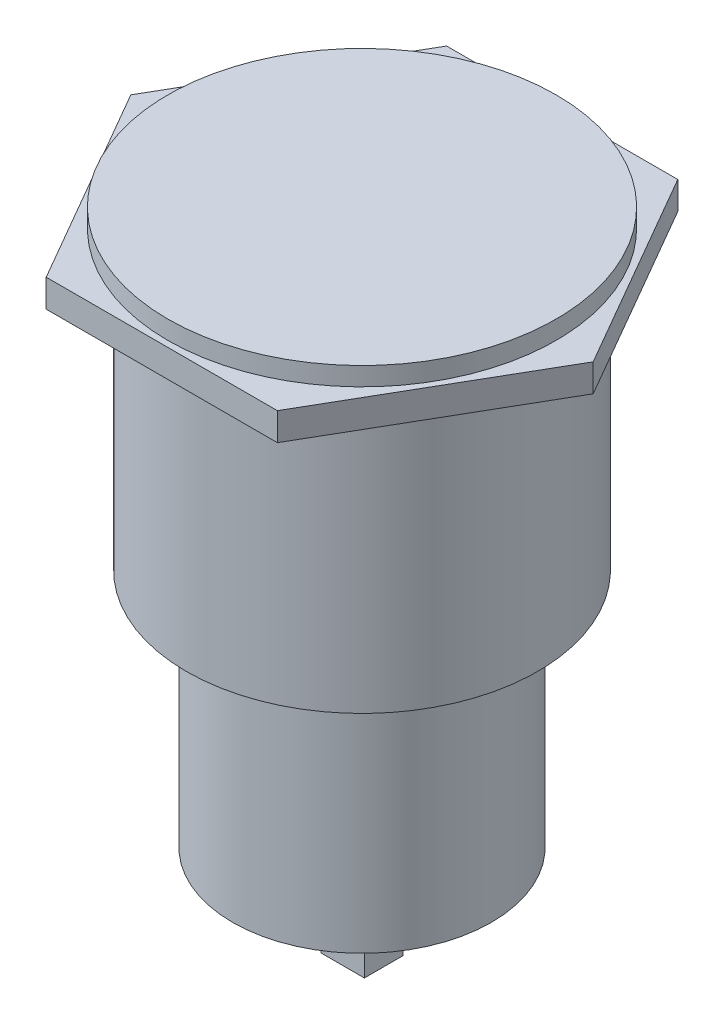
from build123d import *

# Parameters (mm, degrees)
SKETCH1_R           = 9.5
BOSS_EXTRUDE1_DEPTH = 14.5
SKETCH2_R           = 7
BOSS_EXTRUDE2_DEPTH = 13
BOSS_EXTRUDE3_DEPTH = 1.5
SKETCH4_R           = 10.5
BOSS_EXTRUDE4_DEPTH = 1
SKETCH5_W           = 2.336545246
SKETCH5_H           = 2.080922042
BOSS_EXTRUDE5_DEPTH = 5


with BuildPart() as part:
    # Sketch1 → Boss-Extrude1 (new body)
    with BuildSketch(Plane(origin=(0, 0, 0), x_dir=(1, 0, 0), z_dir=(0, 1, 0))):
        with Locations(Location((0, 0, 0), (0, 0, 270))):
            Circle(SKETCH1_R)
    extrude(amount=-BOSS_EXTRUDE1_DEPTH)

    # Sketch2 → Boss-Extrude2 (add)
    with BuildSketch(Plane.XZ.offset(14.5)):
        with Locations(Location((0, 0, 0), (0, 0, 270))):
            Circle(SKETCH2_R)
    extrude(amount=BOSS_EXTRUDE2_DEPTH)

    # Sketch3 → Boss-Extrude3 (add)
    with BuildSketch(Plane(origin=(0, 0, 0), x_dir=(1, 0, 0), z_dir=(0, 1, 0))):
        Polygon((12.5, 0), (6.25, 10.825317547), (-6.25, 10.825317547), (-12.5, 0), (-6.25, -10.825317547), (6.25, -10.825317547), align=None)
    extrude(amount=BOSS_EXTRUDE3_DEPTH)

    # Sketch4 → Boss-Extrude4 (add)
    with BuildSketch(Plane(origin=(0, 1.5, 0), x_dir=(1, 0, 0), z_dir=(0, 1, 0))):
        with Locations(Location((0, 0, 0), (0, 0, 270))):
            Circle(SKETCH4_R)
    extrude(amount=BOSS_EXTRUDE4_DEPTH)

    # Sketch5 → Boss-Extrude5 (add)
    with BuildSketch(Plane.XZ.offset(27.5)):
        Rectangle(SKETCH5_W, SKETCH5_H)
    extrude(amount=BOSS_EXTRUDE5_DEPTH)


solid = part.part
